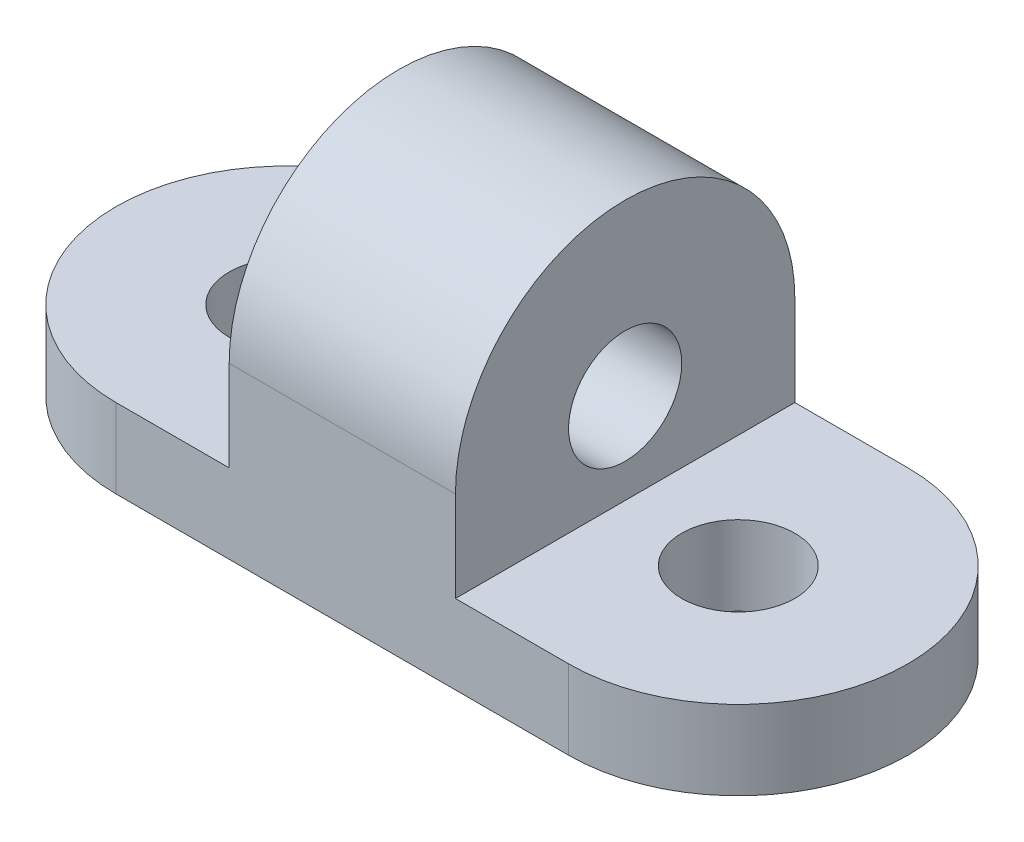
from build123d import *

# Parameters (mm, degrees)
CROQUIS1_R              = 10
SALIENTE_EXTRUIR1_DEPTH = 14
SALIENTE_EXTRUIR2_START = 20
CROQUIS5_R              = 10
SALIENTE_EXTRUIR2_DEPTH = 40


with BuildPart() as part:
    # Croquis1 → Saliente-Extruir1 (new body)
    with BuildSketch(Plane(origin=(0, 0, 0), x_dir=(1, 0, 0), z_dir=(0, 1, 0))):
        with BuildLine():
            Line((0, 0), (80, 0))
            ThreePointArc((80, 0), (110, 30), (80, 60))
            Line((80, 60), (0, 60))
            ThreePointArc((0, 60), (-30, 30), (0, 0))
        make_face()
        with Locations(Location((0, 30, 0), (0, 0, 270))):
            Circle(CROQUIS1_R, mode=Mode.SUBTRACT)
        with Locations(Location((80, 30, 0), (0, 0, 270))):
            Circle(CROQUIS1_R, mode=Mode.SUBTRACT)
    extrude(amount=SALIENTE_EXTRUIR1_DEPTH)

    # Croquis5 → Saliente-Extruir2 (add)
    with BuildSketch(Plane(origin=(0, 0, 0), x_dir=(0, 0, -1), z_dir=(1, 0, 0)).offset(SALIENTE_EXTRUIR2_START)):
        with BuildLine():
            Line((60, 14), (60, 30))
            ThreePointArc((60, 30), (30, 60), (0, 30))
            Line((0, 30), (0, 14))
            Line((0, 14), (60, 14))
        make_face()
        with Locations((30, 30)):
            Circle(CROQUIS5_R, mode=Mode.SUBTRACT)
    extrude(amount=SALIENTE_EXTRUIR2_DEPTH)


solid = part.part
